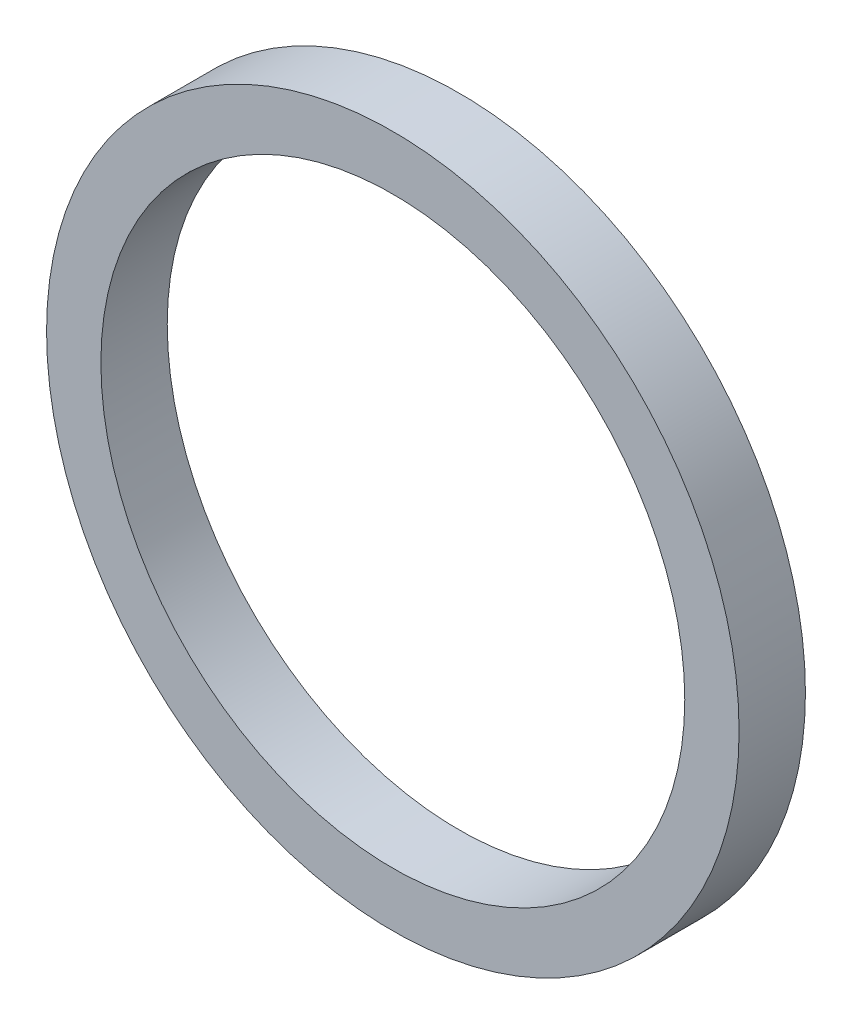
from build123d import *

# Parameters (mm, degrees)
SKETCH1_W = 4
SKETCH1_H = 3.275


with BuildPart() as part:
    # Sketch1 → Revolve1 (revolve)
    with BuildSketch(Plane(origin=(0, 0, 0), x_dir=(0, 0, -1), z_dir=(1, 0, 0)), mode=Mode.PRIVATE) as revolve1_sk:
        with Locations((-2, 19.2375)):
            Rectangle(SKETCH1_W, SKETCH1_H)
    revolve(revolve1_sk.sketch.rotate(Axis((0, 0, 0), (0, 0, 1)), 90), axis=Axis((0, 0, 0), (0, 0, 1)))


solid = part.part
